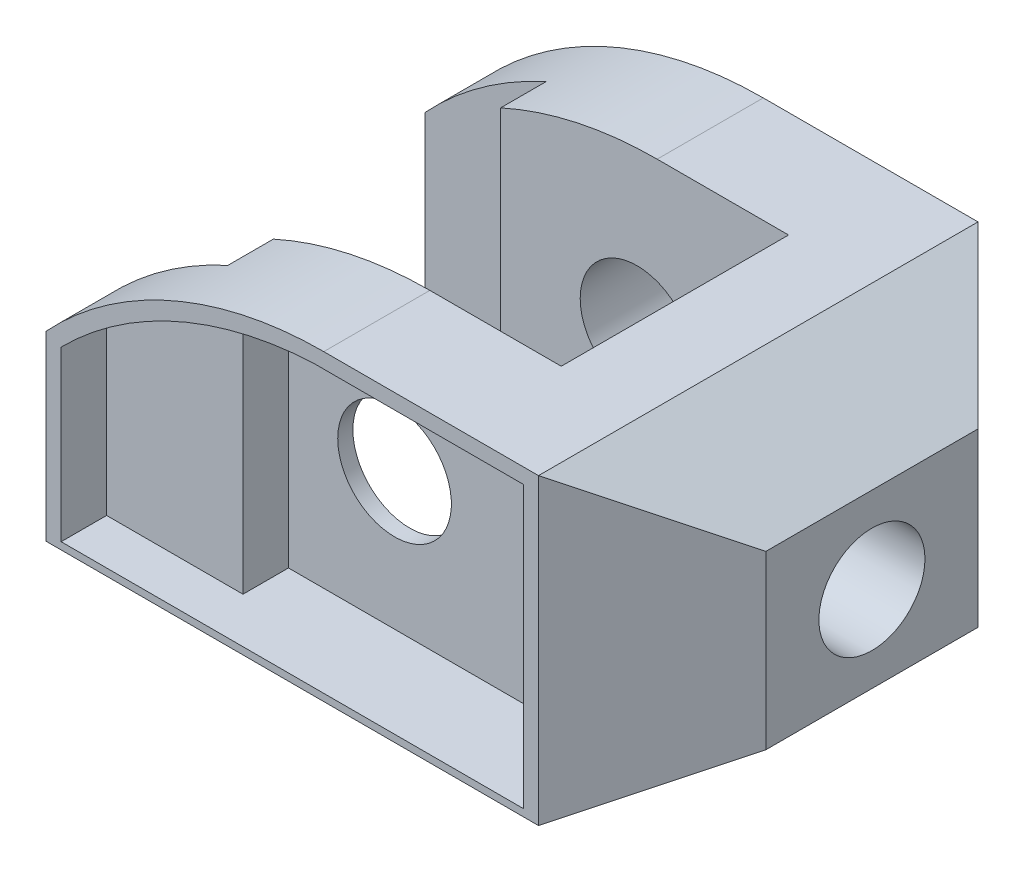
from build123d import *

# Parameters (mm, degrees)
SKETCH3_R           = 7.5
BOSS_EXTRUDE2_DEPTH = 58
CUT_EXTRUDE6_DEPTH  = 58
CUT_EXTRUDE9_DEPTH  = 29
SKETCH10_R          = 7
CUT_EXTRUDE10_DEPTH = 99
CUT_EXTRUDE11_DEPTH = 6
CUT_EXTRUDE12_DEPTH = 6


with BuildPart() as part:
    # Sketch3 → Boss-Extrude2 (new body)
    with BuildSketch(Plane.XY):
        with BuildLine():
            Line((-34, 5), (-34, -19))
            Line((-34, -19), (31, -19))
            Line((31, -19), (46, -10.339745962))
            Line((46, -10.339745962), (46, 12.339745962))
            Line((46, 12.339745962), (31, 21))
            Line((31, 21), (2.66060556, 21))
            ThreePointArc((2.66060556, 21), (-17.33939444, 16.82575695), (-34, 5))
        make_face()
        with Locations(Location((0, 0, 0), (0, 0, 180))):
            Circle(SKETCH3_R, mode=Mode.SUBTRACT)
    extrude(amount=BOSS_EXTRUDE2_DEPTH)

    # Sketch5 → Cut-Extrude6 (cut)
    with BuildSketch(Plane.XZ.offset(19)):
        Polygon((-34, 50), (-18, 50), (-18, 44), (20, 44), (20, 14), (-18, 14), (-18, 8), (-34, 8), align=None)
    extrude(amount=-CUT_EXTRUDE6_DEPTH, mode=Mode.SUBTRACT)

    # Sketch8 → Cut-Extrude9 (cut, symmetric)
    with BuildSketch(Plane(origin=(0, 0, 0), x_dir=(1, 0, 0), z_dir=(0, 1, 0))):
        Polygon((31, 0), (46, 0), (46, -15), align=None)
        Polygon((46, -58), (46, -43), (31, -58), align=None)
    extrude(amount=CUT_EXTRUDE9_DEPTH, both=True, mode=Mode.SUBTRACT)

    # Sketch10 → Cut-Extrude10 (cut, symmetric)
    with BuildSketch(Plane(origin=(46, 0, 0), x_dir=(0, 0, -1), z_dir=(1, 0, 0))):
        with Locations((-29, 1)):
            Circle(SKETCH10_R)
    extrude(amount=CUT_EXTRUDE10_DEPTH, both=True, mode=Mode.SUBTRACT)

    # Sketch11 → Cut-Extrude11 (cut)
    with BuildSketch(Plane.XY.offset(58)):
        with BuildLine():
            Line((29, 19), (29, -18.055637124))
            Line((29, -18.055637124), (-32, -18.055637124))
            Line((-32, -18.055637124), (-32, 4.190762396))
            ThreePointArc((-32, 4.190762396), (-16.740344967, 14.75130403), (1.324280516, 19))
            Line((1.324280516, 19), (29, 19))
        make_face()
    extrude(amount=-CUT_EXTRUDE11_DEPTH, mode=Mode.SUBTRACT)

    # Sketch12 → Cut-Extrude12 (cut)
    with BuildSketch(Plane.XY.offset(52)):
        with BuildLine():
            Line((29, 19), (29, -18.055637124))
            Line((29, -18.055637124), (-14, -18.055637124))
            Line((-14, -18.055637124), (-14, 15.872894945))
            ThreePointArc((-14, 15.872894945), (-6.461238138, 18.041059445), (1.324280516, 19))
            Line((1.324280516, 19), (29, 19))
        make_face()
    extrude(amount=-CUT_EXTRUDE12_DEPTH, mode=Mode.SUBTRACT)


solid = part.part
